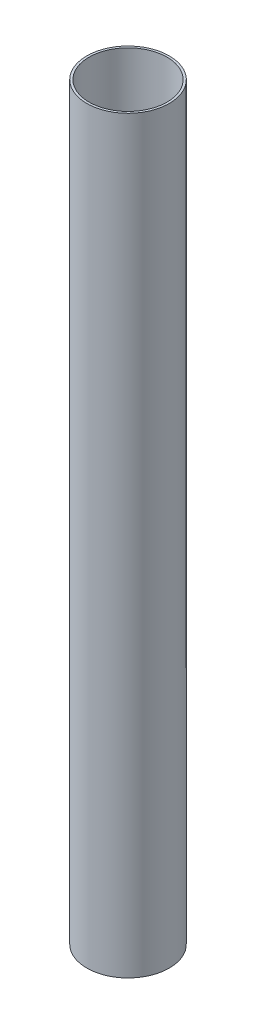
from build123d import *

# Parameters (mm, degrees)
SKETCH2_R           = 33.57
SKETCH2_R_2         = 31.75
BOSS_EXTRUDE1_DEPTH = 609.6


with BuildPart() as part:
    # Sketch2 → Boss-Extrude1 (new body)
    with BuildSketch(Plane(origin=(0, 0, 0), x_dir=(1, 0, 0), z_dir=(0, 1, 0))):
        with Locations(Location((0, 0, 0), (0, 0, 90))):
            Circle(SKETCH2_R)
        with Locations(Location((0, 0, 0), (0, 0, 90))):
            Circle(SKETCH2_R_2, mode=Mode.SUBTRACT)
    extrude(amount=BOSS_EXTRUDE1_DEPTH)


solid = part.part
